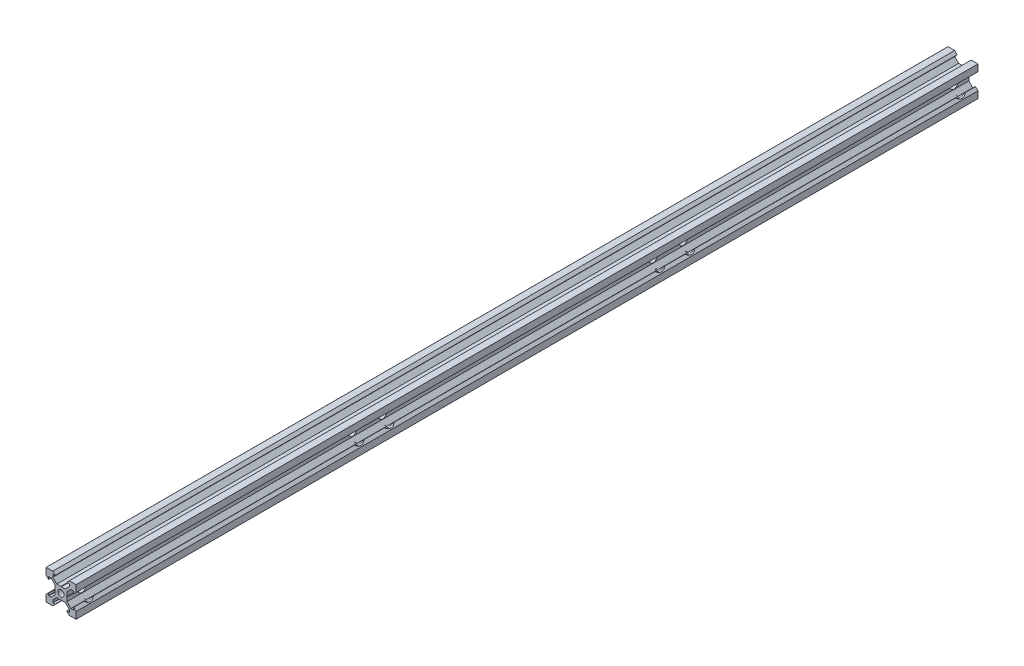
from build123d import *

# Parameters (mm, degrees)
BOSS_EXTRUDE2_DEPTH       = 600
SKETCH2_R                 = 2.1
CUT_EXTRUDE1_DEPTH        = 601.166643525
SKETCH3_R                 = 2.6
CUT_EXTRUDE2_DEPTH        = 601.244291935
SKETCH5_R                 = 5
CUT_EXTRUDE13_DEPTH       = 4
LPATTERN5_COUNT           = 2
LPATTERN5_PITCH           = 200
LPATTERN6_COUNT           = 2
LPATTERN6_PITCH           = 180
LPATTERN7_COUNT           = 2
LPATTERN7_PITCH           = 200
LPATTERN8_COPY_1_SKETCH_R = 2.6
LPATTERN8_COPY_1_DEPTH    = 601.244291935
LPATTERN8_COPY_2_SKETCH_R = 5
LPATTERN8_COPY_2_DEPTH    = 4
LPATTERN8_COPY_3_SKETCH_R = 2.6
LPATTERN8_COPY_3_DEPTH    = 601.244291935
LPATTERN8_COPY_4_SKETCH_R = 5
LPATTERN8_COPY_4_DEPTH    = 4
LPATTERN8_COPY_5_SKETCH_R = 2.6
LPATTERN8_COPY_5_DEPTH    = 601.244291935
LPATTERN8_COPY_6_SKETCH_R = 5
LPATTERN8_COPY_6_DEPTH    = 4
LPATTERN8_COPY_7_SKETCH_R = 2.6
LPATTERN8_COPY_7_DEPTH    = 601.244291935
LPATTERN8_COPY_8_SKETCH_R = 5
LPATTERN8_COPY_8_DEPTH    = 4


with BuildPart() as part:
    # Sketch1 → Boss-Extrude2 (new body)
    with BuildSketch(Plane.XY):
        with BuildLine():
            Line((3.9, 0.15), (3.640192379, 0))
            Line((3.640192379, 0), (3.9, -0.15))
            Line((3.9, -0.15), (3.9, -2.838645193))
            Line((3.9, -2.838645193), (6.532065485, -5.470710678))
            ThreePointArc((6.532065485, -5.470710678), (6.56450782, -5.492387953), (6.602776163, -5.5))
            Line((6.602776163, -5.5), (8.1, -5.5))
            ThreePointArc((8.1, -5.5), (8.170710678, -5.470710678), (8.2, -5.4))
            Line((8.2, -5.4), (8.2, -3.941421356))
            ThreePointArc((8.2, -3.941421356), (8.261731657, -3.849033403), (8.370710678, -3.870710678))
            Line((8.370710678, -3.870710678), (10, -5.5))
            Line((10, -5.5), (10, -10))
            Line((10, -10), (5.5, -10))
            Line((5.5, -10), (3.870710678, -8.370710678))
            ThreePointArc((3.870710678, -8.370710678), (3.849033403, -8.261731657), (3.941421356, -8.2))
            Line((3.941421356, -8.2), (5.4, -8.2))
            ThreePointArc((5.4, -8.2), (5.470710678, -8.170710678), (5.5, -8.1))
            Line((5.5, -8.1), (5.5, -6.602776163))
            ThreePointArc((5.5, -6.602776163), (5.492387953, -6.56450782), (5.470710678, -6.532065485))
            Line((5.470710678, -6.532065485), (2.838645193, -3.9))
            Line((2.838645193, -3.9), (0.15, -3.9))
            Line((0.15, -3.9), (0, -3.640192379))
            Line((0, -3.640192379), (-0.15, -3.9))
            Line((-0.15, -3.9), (-2.838645193, -3.9))
            Line((-2.838645193, -3.9), (-5.470710678, -6.532065485))
            ThreePointArc((-5.470710678, -6.532065485), (-5.492387953, -6.56450782), (-5.5, -6.602776163))
            Line((-5.5, -6.602776163), (-5.5, -8.1))
            ThreePointArc((-5.5, -8.1), (-5.470710678, -8.170710678), (-5.4, -8.2))
            Line((-5.4, -8.2), (-3.941421356, -8.2))
            ThreePointArc((-3.941421356, -8.2), (-3.849033403, -8.261731657), (-3.870710678, -8.370710678))
            Line((-3.870710678, -8.370710678), (-5.5, -10))
            Line((-5.5, -10), (-9.9, -10))
            ThreePointArc((-9.9, -10), (-9.970710678, -9.970710678), (-10, -9.9))
            Line((-10, -9.9), (-10, -5.5))
            Line((-10, -5.5), (-8.370710678, -3.870710678))
            ThreePointArc((-8.370710678, -3.870710678), (-8.261731657, -3.849033403), (-8.2, -3.941421356))
            Line((-8.2, -3.941421356), (-8.2, -5.4))
            ThreePointArc((-8.2, -5.4), (-8.170710678, -5.470710678), (-8.1, -5.5))
            Line((-8.1, -5.5), (-6.602776163, -5.5))
            ThreePointArc((-6.602776163, -5.5), (-6.56450782, -5.492387953), (-6.532065485, -5.470710678))
            Line((-6.532065485, -5.470710678), (-3.9, -2.838645193))
            Line((-3.9, -2.838645193), (-3.9, -0.15))
            Line((-3.9, -0.15), (-3.640192379, 0))
            Line((-3.640192379, 0), (-3.9, 0.15))
            Line((-3.9, 0.15), (-3.9, 2.838645193))
            Line((-3.9, 2.838645193), (-6.532065485, 5.470710678))
            ThreePointArc((-6.532065485, 5.470710678), (-6.56450782, 5.492387953), (-6.602776163, 5.5))
            Line((-6.602776163, 5.5), (-8.1, 5.5))
            ThreePointArc((-8.1, 5.5), (-8.170710678, 5.470710678), (-8.2, 5.4))
            Line((-8.2, 5.4), (-8.2, 3.941421356))
            ThreePointArc((-8.2, 3.941421356), (-8.261731657, 3.849033403), (-8.370710678, 3.870710678))
            Line((-8.370710678, 3.870710678), (-10, 5.5))
            Line((-10, 5.5), (-10, 9.9))
            ThreePointArc((-10, 9.9), (-9.970710678, 9.970710678), (-9.9, 10))
            Line((-9.9, 10), (-5.5, 10))
            Line((-5.5, 10), (-3.870710678, 8.370710678))
            ThreePointArc((-3.870710678, 8.370710678), (-3.849033403, 8.261731657), (-3.941421356, 8.2))
            Line((-3.941421356, 8.2), (-5.4, 8.2))
            ThreePointArc((-5.4, 8.2), (-5.470710678, 8.170710678), (-5.5, 8.1))
            Line((-5.5, 8.1), (-5.5, 6.602776163))
            ThreePointArc((-5.5, 6.602776163), (-5.492387953, 6.56450782), (-5.470710678, 6.532065485))
            Line((-5.470710678, 6.532065485), (-2.838645193, 3.9))
            Line((-2.838645193, 3.9), (-0.15, 3.9))
            Line((-0.15, 3.9), (0, 3.640192379))
            Line((0, 3.640192379), (0.15, 3.9))
            Line((0.15, 3.9), (2.838645193, 3.9))
            Line((2.838645193, 3.9), (5.470710678, 6.532065485))
            ThreePointArc((5.470710678, 6.532065485), (5.492387953, 6.56450782), (5.5, 6.602776163))
            Line((5.5, 6.602776163), (5.5, 8.1))
            ThreePointArc((5.5, 8.1), (5.470710678, 8.170710678), (5.4, 8.2))
            Line((5.4, 8.2), (3.941421356, 8.2))
            ThreePointArc((3.941421356, 8.2), (3.849033403, 8.261731657), (3.870710678, 8.370710678))
            Line((3.870710678, 8.370710678), (5.5, 10))
            Line((5.5, 10), (10, 10))
            Line((10, 10), (10, 5.5))
            Line((10, 5.5), (8.370710678, 3.870710678))
            ThreePointArc((8.370710678, 3.870710678), (8.261731657, 3.849033403), (8.2, 3.941421356))
            Line((8.2, 3.941421356), (8.2, 5.4))
            ThreePointArc((8.2, 5.4), (8.170710678, 5.470710678), (8.1, 5.5))
            Line((8.1, 5.5), (6.602776163, 5.5))
            ThreePointArc((6.602776163, 5.5), (6.56450782, 5.492387953), (6.532065485, 5.470710678))
            Line((6.532065485, 5.470710678), (3.9, 2.838645193))
            Line((3.9, 2.838645193), (3.9, 0.15))
        make_face()
    extrude(amount=-BOSS_EXTRUDE2_DEPTH)

    # Sketch2 → Cut-Extrude1 (cut, through all)
    with BuildSketch(Plane.XY):
        Circle(SKETCH2_R)
    cut_extrude1 = extrude(amount=-CUT_EXTRUDE1_DEPTH, mode=Mode.SUBTRACT)

    # Sketch3 → Cut-Extrude2 (cut, through all)
    with BuildSketch(Plane(origin=(3.9, 0, 0), x_dir=(0, 0, -1), z_dir=(1, 0, 0))):
        with Locations((10, 0)):
            Circle(SKETCH3_R)
    cut_extrude2 = extrude(amount=-CUT_EXTRUDE2_DEPTH, mode=Mode.SUBTRACT)

    # Sketch5 → Cut-Extrude13 (cut)
    with BuildSketch(Plane(origin=(10, 0, 0), x_dir=(0, 0, -1), z_dir=(1, 0, 0))):
        with Locations((10, 0)):
            Circle(SKETCH5_R)
    cut_extrude13 = extrude(amount=-CUT_EXTRUDE13_DEPTH, mode=Mode.SUBTRACT)

    # Mirror2: Cut-Extrude2, Cut-Extrude13 across plane
    add(cut_extrude2.mirror(Plane.XY.offset(-300)), mode=Mode.SUBTRACT)
    add(cut_extrude13.mirror(Plane.XY.offset(-300)), mode=Mode.SUBTRACT)

    # LPattern5: Cut-Extrude1, Cut-Extrude2, Cut-Extrude13 ×2
    with Locations(*[(0, 0, i * LPATTERN5_PITCH) for i in range(1, LPATTERN5_COUNT)]):
        add(cut_extrude1, mode=Mode.SUBTRACT)
        add(cut_extrude2, mode=Mode.SUBTRACT)
        add(cut_extrude13, mode=Mode.SUBTRACT)

    # LPattern6: Cut-Extrude2, Cut-Extrude13 ×2
    with Locations(*[(0, 0, -i * LPATTERN6_PITCH) for i in range(1, LPATTERN6_COUNT)]):
        add(cut_extrude2, mode=Mode.SUBTRACT)
        add(cut_extrude13, mode=Mode.SUBTRACT)

    # LPattern7: Cut-Extrude2, Cut-Extrude13 ×2
    with Locations(*[(0, 0, -i * LPATTERN7_PITCH) for i in range(1, LPATTERN7_COUNT)]):
        add(cut_extrude2, mode=Mode.SUBTRACT)
        add(cut_extrude13, mode=Mode.SUBTRACT)

    # LPattern8 copy 1 sketch → LPattern8 copy 1 (cut, through all)
    with BuildSketch(Plane(origin=(3.9, 0, -380), x_dir=(0, 0, -1), z_dir=(1, 0, 0))):
        with Locations((10, 0)):
            Circle(LPATTERN8_COPY_1_SKETCH_R)
    extrude(amount=-LPATTERN8_COPY_1_DEPTH, mode=Mode.SUBTRACT)

    # LPattern8 copy 2 sketch → LPattern8 copy 2 (cut)
    with BuildSketch(Plane(origin=(10, 0, -380), x_dir=(0, 0, -1), z_dir=(1, 0, 0))):
        with Locations((10, 0)):
            Circle(LPATTERN8_COPY_2_SKETCH_R)
    extrude(amount=-LPATTERN8_COPY_2_DEPTH, mode=Mode.SUBTRACT)

    # LPattern8 copy 3 sketch → LPattern8 copy 3 (cut, through all)
    with BuildSketch(Plane(origin=(3.9, 0, -200), x_dir=(0, 0, -1), z_dir=(1, 0, 0))):
        with Locations((10, 0)):
            Circle(LPATTERN8_COPY_3_SKETCH_R)
    extrude(amount=-LPATTERN8_COPY_3_DEPTH, mode=Mode.SUBTRACT)

    # LPattern8 copy 4 sketch → LPattern8 copy 4 (cut)
    with BuildSketch(Plane(origin=(10, 0, -200), x_dir=(0, 0, -1), z_dir=(1, 0, 0))):
        with Locations((10, 0)):
            Circle(LPATTERN8_COPY_4_SKETCH_R)
    extrude(amount=-LPATTERN8_COPY_4_DEPTH, mode=Mode.SUBTRACT)

    # LPattern8 copy 5 sketch → LPattern8 copy 5 (cut, through all)
    with BuildSketch(Plane(origin=(3.9, 0, -400), x_dir=(0, 0, -1), z_dir=(1, 0, 0))):
        with Locations((10, 0)):
            Circle(LPATTERN8_COPY_5_SKETCH_R)
    extrude(amount=-LPATTERN8_COPY_5_DEPTH, mode=Mode.SUBTRACT)

    # LPattern8 copy 6 sketch → LPattern8 copy 6 (cut)
    with BuildSketch(Plane(origin=(10, 0, -400), x_dir=(0, 0, -1), z_dir=(1, 0, 0))):
        with Locations((10, 0)):
            Circle(LPATTERN8_COPY_6_SKETCH_R)
    extrude(amount=-LPATTERN8_COPY_6_DEPTH, mode=Mode.SUBTRACT)

    # LPattern8 copy 7 sketch → LPattern8 copy 7 (cut, through all)
    with BuildSketch(Plane(origin=(3.9, 0, -200), x_dir=(0, 0, -1), z_dir=(1, 0, 0))):
        with Locations((10, 0)):
            Circle(LPATTERN8_COPY_7_SKETCH_R)
    extrude(amount=-LPATTERN8_COPY_7_DEPTH, mode=Mode.SUBTRACT)

    # LPattern8 copy 8 sketch → LPattern8 copy 8 (cut)
    with BuildSketch(Plane(origin=(10, 0, -200), x_dir=(0, 0, -1), z_dir=(1, 0, 0))):
        with Locations((10, 0)):
            Circle(LPATTERN8_COPY_8_SKETCH_R)
    extrude(amount=-LPATTERN8_COPY_8_DEPTH, mode=Mode.SUBTRACT)


solid = part.part
